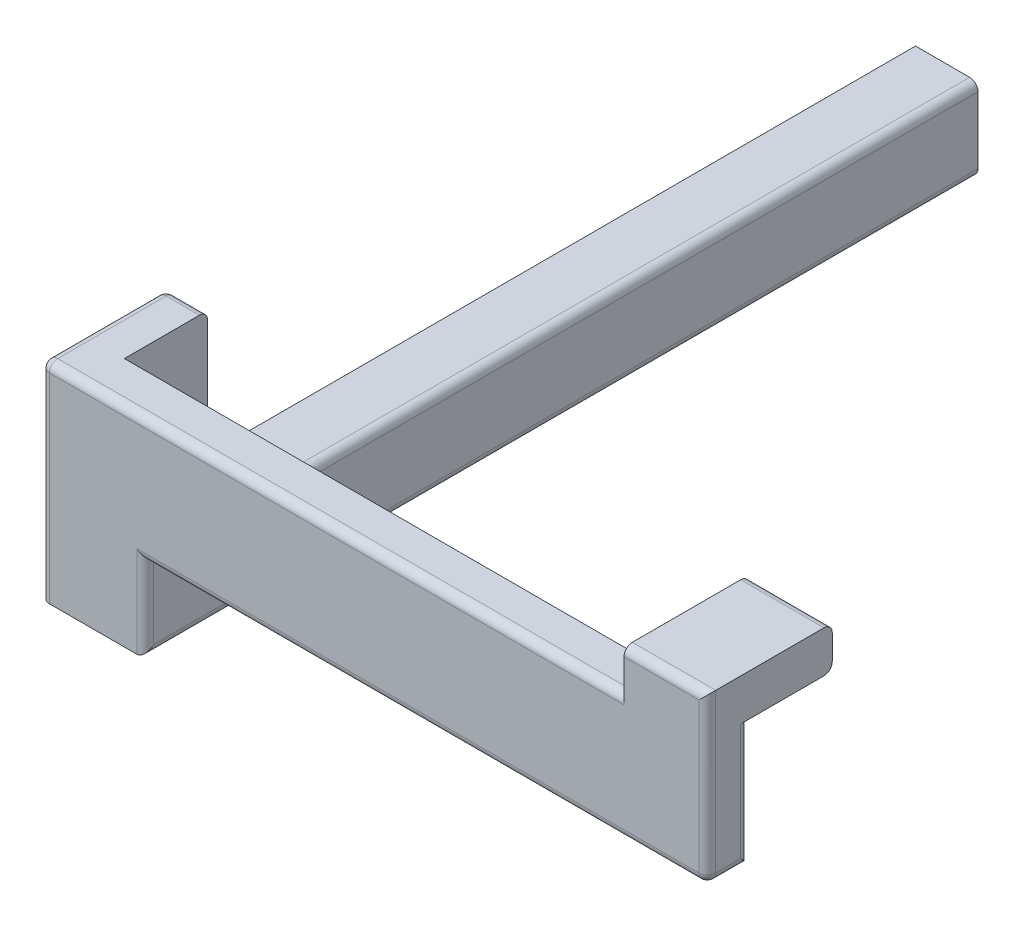
from build123d import *

# Parameters (mm, degrees)
LONG_LEG_W             = 30
LONG_LEG_H             = 150
LONG_LEG_EXTRUDE_DEPTH = 10
SKETCH2_W              = 30
SKETCH2_H              = 30
BOSS_EXTRUDE2_DEPTH    = 10
SKETCH6_W              = 15
SKETCH6_H              = 10
LONG_LEG_DOWN_DEPTH    = 20
SKETCH12_W             = 20
SKETCH12_H             = 30
BOSS_EXTRUDE8_DEPTH    = 10
SKETCH13_W             = 6
SKETCH13_H             = 5
CUT_EXTRUDE2_DEPTH     = 10
FILLET1_R              = 2
FILLET2_R              = 2
FILLET3_R              = 2
FILLET4_R              = 2


with BuildPart() as part:
    # long-leg → long_leg_extrude (new body)
    with BuildSketch(Plane(origin=(0, 0, 0), x_dir=(0, 1, 0), z_dir=(0, 0, 1))):
        with Locations((-2.514124294, -68.610169492)):
            Rectangle(LONG_LEG_W, LONG_LEG_H)
    extrude(amount=LONG_LEG_EXTRUDE_DEPTH)

    # Sketch2 → Boss-Extrude2 (add)
    with BuildSketch(Plane(origin=(-6.389830508, 0, 0), x_dir=(0, -1, 0), z_dir=(-1, 0, 0))):
        with Locations((2.514124294, -5)):
            Rectangle(SKETCH2_W, SKETCH2_H)
    extrude(amount=BOSS_EXTRUDE2_DEPTH)

    # Sketch6 → long leg down (add)
    with BuildSketch(Plane.XZ.offset(17.514124294)):
        Polygon((-6.389830508, 0), (-6.389830508, 10), (-16.389830508, 10), (-16.389830508, -20), (-6.389830508, -20), align=None)
        Polygon((8.610169492, 0), (-6.389830508, 0), (-6.389830508, -20), (-6.389830508, -190), (8.610169492, -190), align=None)
        with Locations((1.110169492, 5)):
            Rectangle(SKETCH6_W, SKETCH6_H)
    extrude(amount=LONG_LEG_DOWN_DEPTH)

    # Sketch12 → Boss-Extrude8 (add)
    with BuildSketch(Plane(origin=(0, 12.485875706, 0), x_dir=(-1, 0, 0), z_dir=(0, 1, 0))):
        with Locations((-133.610169492, -5)):
            Rectangle(SKETCH12_W, SKETCH12_H)
    extrude(amount=BOSS_EXTRUDE8_DEPTH)

    # Sketch13 → Cut-Extrude2 (cut)
    with BuildSketch(Plane(origin=(-6.389830508, 0, 0), x_dir=(0, -1, 0), z_dir=(-1, 0, 0))):
        Polygon((24.559120017, -185), (30.559120017, -185), (33.559120017, -185), (33.559120017, -180), (21.559120017, -180), (21.559120017, -185), align=None)
        with Locations((27.559120017, -187.5)):
            Rectangle(SKETCH13_W, SKETCH13_H)
    extrude(amount=-CUT_EXTRUDE2_DEPTH, mode=Mode.SUBTRACT)

    # Fillet1
    fillet1_edges = [part.edges().sort_by_distance(p)[0] for p in [
        (133.610169492, 12.485875706, -20),
        (133.610169492, 22.485875706, -20),
        (133.610169492, 22.485875706, 10),
        (143.610169492, 2.485875706, 10),
        (-16.389830508, -12.514124294, 10),
        (-16.389830508, -12.514124294, -20),
    ]]
    fillet(fillet1_edges, radius=FILLET1_R)

    # Fillet2
    fillet2_edges = [part.edges().sort_by_distance(p)[0] for p in [
        (143.610169492, -17.514124294, 4),
        (143.024383054, -17.514124294, 9.414213562),
        (75.110169492, -17.514124294, 10),
        (8.610169492, -37.514124294, -90),
        (8.610169492, -27.514124294, 10),
        (-6.389830508, -37.514124294, -105),
        (143.610169492, -2.514124294, 0),
    ]]
    fillet(fillet2_edges, radius=FILLET2_R)

    # Fillet3
    fillet3_edges = [part.edges().sort_by_distance(p)[0] for p in [
        (8.610169492, -17.514124294, -95),
    ]]
    fillet(fillet3_edges, radius=FILLET3_R)

    # Fillet4
    fillet4_edges = [part.edges().sort_by_distance(p)[0] for p in [
        (-16.389830508, 12.485875706, -5),
        (-10.389830508, 12.485875706, -20),
        (-15.804044071, 12.485875706, -19.414213562),
        (-15.804044071, 12.485875706, 9.414213562),
        (54.610169492, 12.485875706, 10),
    ]]
    fillet(fillet4_edges, radius=FILLET4_R)


solid = part.part
